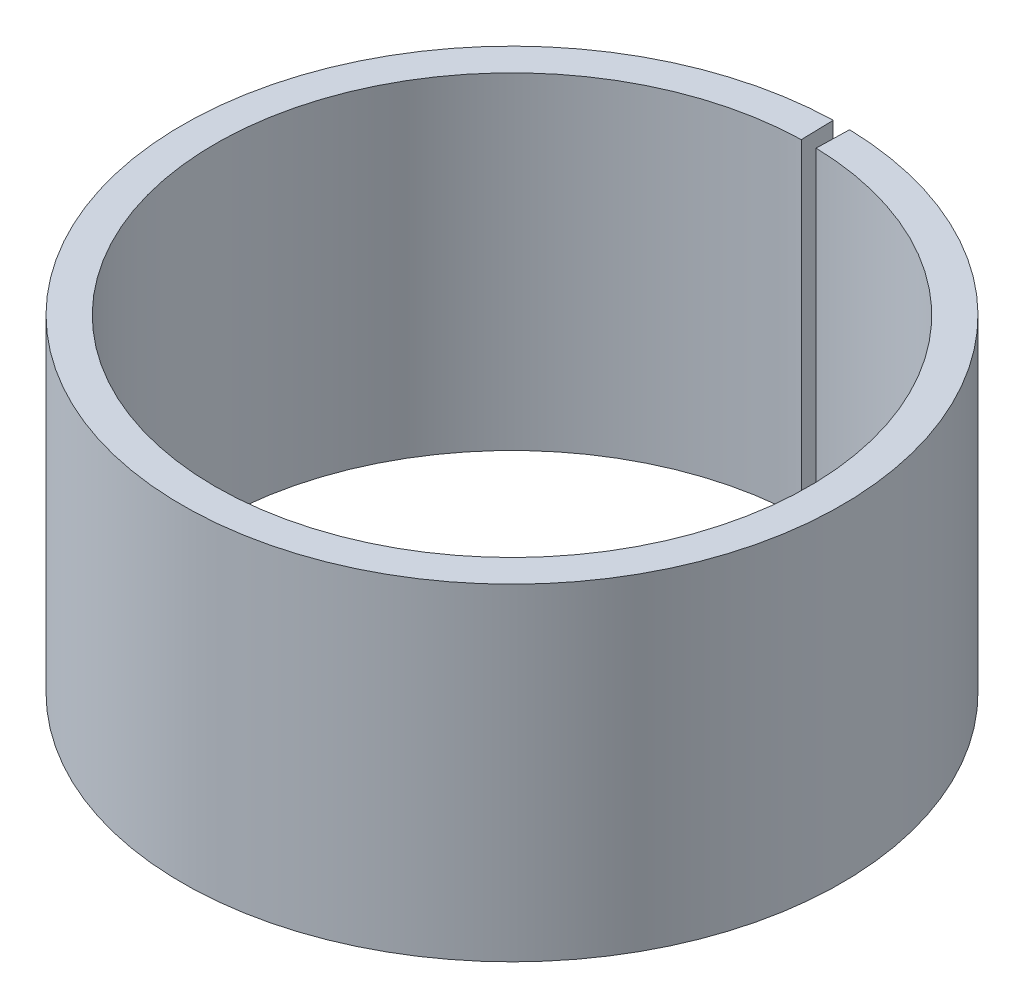
from build123d import *

# Parameters (mm, degrees)
BOSS_EXTRUDE1_DEPTH = 50.8


with BuildPart() as part:
    # Sketch1 → Boss-Extrude1 (new body)
    with BuildSketch(Plane(origin=(0, 0, 0), x_dir=(1, 0, 0), z_dir=(0, 1, 0))):
        with BuildLine():
            Line((1.143945409, 46.086804944), (1.27, 51.16524075))
            ThreePointArc((1.27, 51.16524075), (0, -51.181), (-1.27, 51.16524075))
            Line((-1.27, 51.16524075), (-1.143945409, 46.086804944))
            ThreePointArc((-1.143945409, 46.086804944), (0, -46.101), (1.143945409, 46.086804944))
        make_face()
    extrude(amount=BOSS_EXTRUDE1_DEPTH)


solid = part.part
